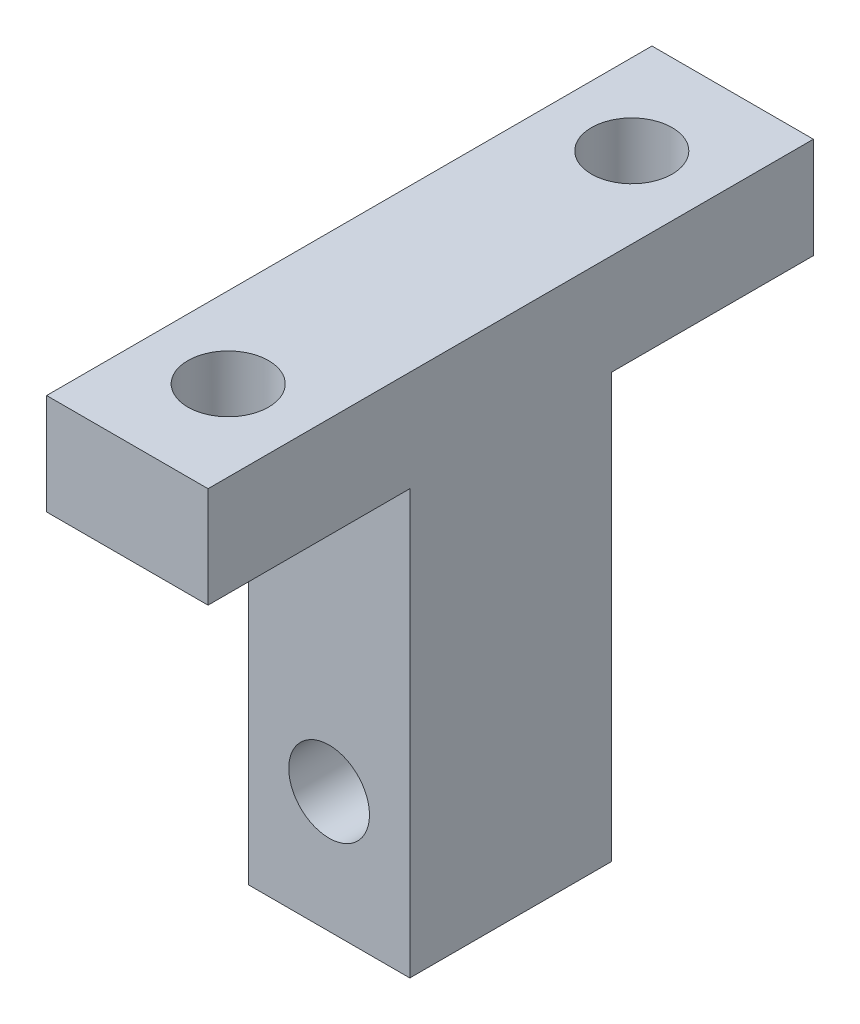
from build123d import *

# Parameters (mm, degrees)
EXTRUDE_1_DEPTH          = 4
CUT_EXTRUDE_1_REACH      = 32.282
SKETCH_2_R               = 2
CUT_EXTRUDE_2_DEPTH      = 31.282007859
CUT_EXTRUDE_2_DEPTH_BACK = 31.282007859
SKETCH_3_R               = 2


with BuildPart() as part:
    # 草图1 → 凸台-拉伸1 (new, symmetric)
    with BuildSketch(Plane(origin=(0, 0, 0), x_dir=(0, 0, -1), z_dir=(1, 0, 0))):
        Polygon((-15, 0), (-15, -5), (-5, -5), (-5, -26), (5, -26), (5, -5), (15, -5), (15, 0), (0, 0), align=None)
    extrude(amount=EXTRUDE_1_DEPTH, both=True)

    # 草图2 → 切除-拉伸1 (cut, up to next)
    with BuildSketch(Plane(origin=(0, 0, 0), x_dir=(1, 0, 0), z_dir=(0, 1, 0)), mode=Mode.PRIVATE) as cut_extrude_1_sk1:
        with Locations(Location((0, 10, 0), (0, 0, 270))):
            Circle(SKETCH_2_R)
    cut_extrude_1_tool1 = extrude(cut_extrude_1_sk1.sketch, amount=-CUT_EXTRUDE_1_REACH, mode=Mode.PRIVATE) & part.part
    # 草图2 → 切除-拉伸1 (cut, up to next)
    with BuildSketch(Plane(origin=(0, 0, 0), x_dir=(1, 0, 0), z_dir=(0, 1, 0)), mode=Mode.PRIVATE) as cut_extrude_1_sk2:
        with Locations(Location((0, -10, 0), (0, 0, 270))):
            Circle(SKETCH_2_R)
    cut_extrude_1_tool2 = extrude(cut_extrude_1_sk2.sketch, amount=-CUT_EXTRUDE_1_REACH, mode=Mode.PRIVATE) & part.part
    add(cut_extrude_1_tool1.solids().sort_by_distance((0, 0, -10))[0], mode=Mode.SUBTRACT)
    add(cut_extrude_1_tool2.solids().sort_by_distance((0, 0, 10))[0], mode=Mode.SUBTRACT)

    # 草图3 → 切除-拉伸2 (cut, two sides: drawn at the far end of the back side and taken through both)
    with BuildSketch(Plane.XY.offset(-CUT_EXTRUDE_2_DEPTH_BACK)):
        with Locations(Location((0, -20, 0), (0, 0, 270))):
            Circle(SKETCH_3_R)
    extrude(amount=CUT_EXTRUDE_2_DEPTH + CUT_EXTRUDE_2_DEPTH_BACK, mode=Mode.SUBTRACT)


solid = part.part
